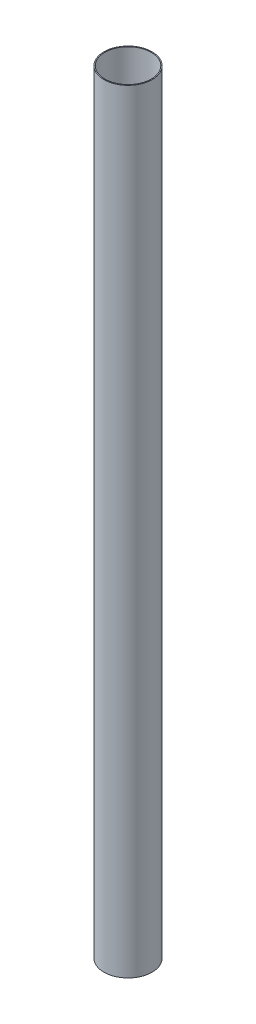
from build123d import *

# Parameters (mm, degrees)
SKETCH1_R           = 39.624
SKETCH1_R_2         = 38.1
BOSS_EXTRUDE1_DEPTH = 1270


with BuildPart() as part:
    # Sketch1 → Boss-Extrude1 (new body)
    with BuildSketch(Plane(origin=(0, 0, 0), x_dir=(1, 0, 0), z_dir=(0, 1, 0))):
        with Locations(Location((0, 0, 0), (0, 0, 90))):
            Circle(SKETCH1_R)
        with Locations(Location((0, 0, 0), (0, 0, 90))):
            Circle(SKETCH1_R_2, mode=Mode.SUBTRACT)
    extrude(amount=BOSS_EXTRUDE1_DEPTH)


solid = part.part
